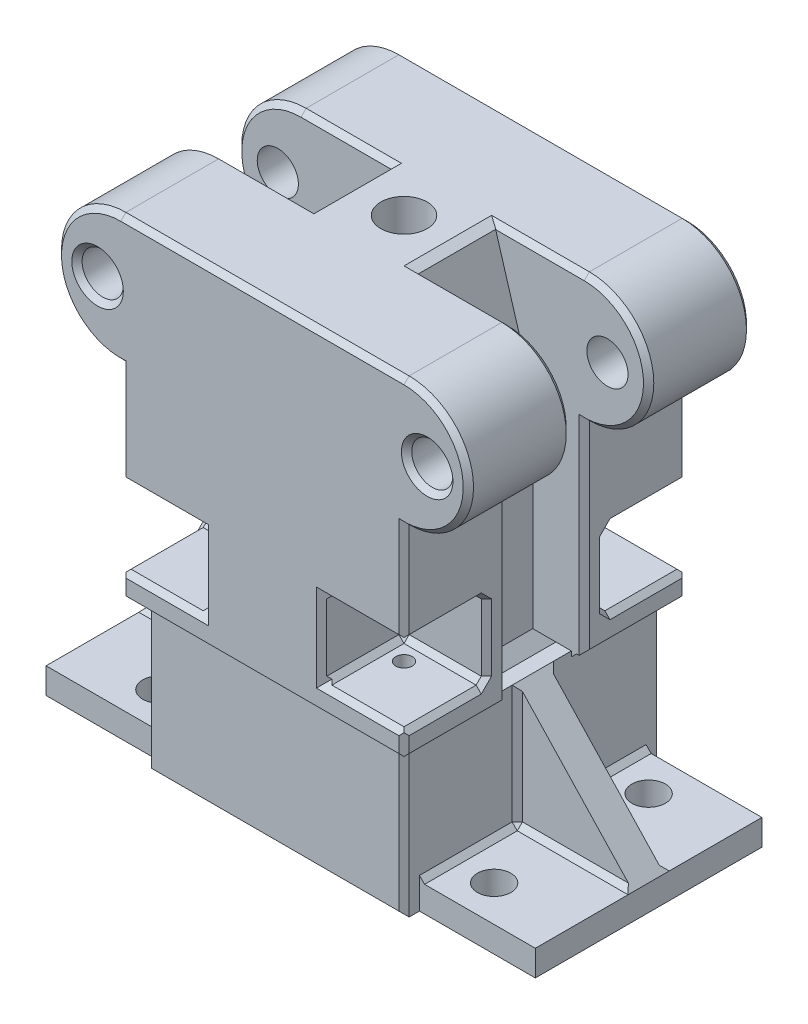
from build123d import *
from OCP.BRepFilletAPI import BRepFilletAPI_MakeChamfer

# Parameters (mm, degrees)
CROQUIS1_W              = 80
CROQUIS1_H              = 25
CROQUIS1_R              = 4
SALIENTE_EXTRUIR1_DEPTH = 27.5
REDONDEO1_RADIUS        = 12.5
REDONDEO1_LENGTH        = 55
REDONDEO2_RADIUS        = 12.5
REDONDEO2_LENGTH        = 55
CROQUIS2_R              = 4.5
CROQUIS2_W              = 12.5
CROQUIS2_H              = 15
CORTAR_EXTRUIR1_DEPTH   = 55.60082417
CORTAR_EXTRUIR2_START   = -20
CORTAR_EXTRUIR2_DEPTH   = 15
SKETCH3_R               = 4.5
BOSS_EXTRUDE1_DEPTH     = 39.5
SKETCH5_R               = 15
CUT_EXTRUDE1_DEPTH      = 3
SKETCH7_R               = 1.6
CUT_EXTRUDE3_DEPTH      = 15
CIRPATTERN1_COUNT       = 4
SKETCH6_R               = 10.5
CUT_EXTRUDE2_DEPTH      = 42
SKETCH8_W               = 8
SKETCH8_H               = 8
CUT_EXTRUDE4_DEPTH      = 15
CIRPATTERN2_COUNT       = 4
SKETCH10_W              = 50
SKETCH10_H              = 50
SKETCH10_W_2            = 44
SKETCH10_H_2            = 44
BOSS_EXTRUDE2_DEPTH     = 29
SKETCH14_W              = 22.5
SKETCH14_H              = 44
BOSS_EXTRUDE3_DEPTH     = 5
SKETCH15_R              = 3.25
CUT_EXTRUDE5_DEPTH      = 7
CHAMFER1_SIZE           = 1
CHAMFER2_SIZE           = 1
CHAMFER2_SIZE2          = 1.491472358
RIB1_REACH              = 99.844
SKETCH16_WALL_W         = 230.586096322
SKETCH16_WALL_H         = 6
CHAMFER3_SIZE           = 1
CHAMFER4_SIZE           = 1


with BuildPart() as part:
    # Croquis1 → Saliente-Extruir1 (new, symmetric)
    with BuildSketch(Plane.XY):
        Rectangle(CROQUIS1_W, CROQUIS1_H)
        with Locations((-32, 0)):
            Circle(CROQUIS1_R, mode=Mode.SUBTRACT)
        with Locations((32, 0)):
            Circle(CROQUIS1_R, mode=Mode.SUBTRACT)
    extrude(amount=SALIENTE_EXTRUIR1_DEPTH, both=True)

    # Redondeo1: full round fillet: the end face becomes a half cylinder, R = half its width
    redondeo1_face = Plane((-40, 0, 0), x_dir=(0, 0, 1), z_dir=(-1, 0, 0))  # on the end face: x along it, z out of the body
    redondeo1_slab = redondeo1_face.offset(-REDONDEO1_RADIUS / 2) * Box(REDONDEO1_LENGTH, 2 * REDONDEO1_RADIUS, REDONDEO1_RADIUS, mode=Mode.PRIVATE)  # the body's end, R deep
    redondeo1_round = Plane((-27.5, 0, 0), x_dir=(-1, 0, 0), z_dir=(0, 0, 1)) * Cylinder(REDONDEO1_RADIUS, REDONDEO1_LENGTH, mode=Mode.PRIVATE)  # its axis R under the face
    add(redondeo1_slab - redondeo1_round, mode=Mode.SUBTRACT)

    # Redondeo2: full round fillet: the end face becomes a half cylinder, R = half its width
    redondeo2_face = Plane((40, 0, 0), x_dir=(0, 0, -1), z_dir=(1, 0, 0))  # on the end face: x along it, z out of the body
    redondeo2_slab = redondeo2_face.offset(-REDONDEO2_RADIUS / 2) * Box(REDONDEO2_LENGTH, 2 * REDONDEO2_RADIUS, REDONDEO2_RADIUS, mode=Mode.PRIVATE)  # the body's end, R deep
    redondeo2_round = Plane((27.5, 0, 0), x_dir=(1, 0, 0), z_dir=(0, 0, -1)) * Cylinder(REDONDEO2_RADIUS, REDONDEO2_LENGTH, mode=Mode.PRIVATE)  # its axis R under the face
    add(redondeo2_slab - redondeo2_round, mode=Mode.SUBTRACT)

    # Croquis2 → Cortar-Extruir1 (cut, through all)
    with BuildSketch(Plane(origin=(0, 12.5, 0), x_dir=(1, 0, 0), z_dir=(0, 1, 0))):
        with Locations(Location((0, 0, 0), (0, 0, 270))):
            Circle(CROQUIS2_R)
        with Locations((-33.75, 0)):
            Rectangle(CROQUIS2_W, CROQUIS2_H)
        with Locations((33.75, 0)):
            Rectangle(CROQUIS2_W, CROQUIS2_H)
    extrude(amount=-CORTAR_EXTRUIR1_DEPTH, mode=Mode.SUBTRACT)

    # Croquis3 → Cortar-Extruir2 (cut)
    with BuildSketch(Plane(origin=(0, 0, -27.5), x_dir=(-1, 0, 0), z_dir=(0, 0, -1)).offset(CORTAR_EXTRUIR2_START)):
        Polygon((10, 12.5), (27.5, 12.5), (27.5, -12.5), (17.5, -12.5), align=None)
    cortar_extruir2 = extrude(amount=-CORTAR_EXTRUIR2_DEPTH, mode=Mode.SUBTRACT)

    # Simetría1: Cortar-Extruir2 across plane
    add(cortar_extruir2.mirror(Plane(origin=(0, 0, 0), x_dir=(0, 0, 1), z_dir=(1, 0, 0))), mode=Mode.SUBTRACT)

    # Sketch3 → Boss-Extrude1 (add)
    with BuildSketch(Plane.XZ.offset(12.5)):
        Polygon((27.5, -7.5), (17.5, -7.5), (17.5, 7.5), (27.5, 7.5), (27.5, 27.5), (-27.5, 27.5), (-27.5, 7.5), (-17.5, 7.5), (-17.5, -7.5), (-27.5, -7.5), (-27.5, -27.5), (27.5, -27.5), align=None)
        with Locations(Location((0, 0, 0), (0, 0, 90))):
            Circle(SKETCH3_R, mode=Mode.SUBTRACT)
    extrude(amount=BOSS_EXTRUDE1_DEPTH)

    # Sketch5 → Cut-Extrude1 (cut)
    with BuildSketch(Plane.XZ.offset(52)):
        with Locations(Location((0, 0, 0), (0, 0, 270))):
            Circle(SKETCH5_R)
    extrude(amount=-CUT_EXTRUDE1_DEPTH, mode=Mode.SUBTRACT)

    # Sketch7 → Cut-Extrude3 (cut)
    with BuildSketch(Plane.XZ.offset(52)):
        with Locations(Location((-15.5, 15.5, 0), (0, 0, 270))):
            Circle(SKETCH7_R)
    cut_extrude3 = extrude(amount=-CUT_EXTRUDE3_DEPTH, mode=Mode.SUBTRACT)

    # CirPattern1: Cut-Extrude3 ×4 about axis
    cirpattern1_axis = Axis((0, 0, 0), (0, 1, 0))
    for i in range(1, CIRPATTERN1_COUNT):
        add(cut_extrude3.rotate(cirpattern1_axis, i * 360 / CIRPATTERN1_COUNT), mode=Mode.SUBTRACT)

    # Sketch6 → Cut-Extrude2 (cut)
    with BuildSketch(Plane.XZ.offset(49)):
        with Locations(Location((0, 0, 0), (0, 0, 270))):
            Circle(SKETCH6_R)
    extrude(amount=-CUT_EXTRUDE2_DEPTH, mode=Mode.SUBTRACT)

    # Sketch8 → Cut-Extrude4 (cut)
    with BuildSketch(Plane(origin=(0, -47, 0), x_dir=(-1, 0, 0), z_dir=(0, -1, 0))):
        Polygon((-27.5, 27.5), (-11.5, 27.5), (-11.5, 19.5), (-19.5, 19.5), (-19.5, 11.5), (-27.5, 11.5), align=None)
        with Locations((-15.5, 15.5)):
            Rectangle(SKETCH8_W, SKETCH8_H)
    cut_extrude4 = extrude(amount=-CUT_EXTRUDE4_DEPTH, mode=Mode.SUBTRACT)

    # CirPattern2: Cut-Extrude4 ×4 about axis
    cirpattern2_axis = Axis((0, -49, 0), (0, -1, 0))
    for i in range(1, CIRPATTERN2_COUNT):
        add(cut_extrude4.rotate(cirpattern2_axis, i * 360 / CIRPATTERN2_COUNT), mode=Mode.SUBTRACT)

    # Sketch10 → Boss-Extrude2 (add)
    with BuildSketch(Plane.XZ.offset(52)):
        Rectangle(SKETCH10_W, SKETCH10_H)
        Rectangle(SKETCH10_W_2, SKETCH10_H_2, mode=Mode.SUBTRACT)
    extrude(amount=BOSS_EXTRUDE2_DEPTH)

    # Sketch14 → Boss-Extrude3 (add)
    with BuildSketch(Plane.XZ.offset(81)):
        with Locations((-36.25, 0)):
            Rectangle(SKETCH14_W, SKETCH14_H)
        with Locations((36.25, 0)):
            Rectangle(SKETCH14_W, SKETCH14_H)
    extrude(amount=-BOSS_EXTRUDE3_DEPTH)

    # Sketch15 → Cut-Extrude5 (cut)
    with BuildSketch(Plane.XZ.offset(81)):
        with Locations(Location((-32.5, 15, 0), (0, 0, 270))):
            Circle(SKETCH15_R)
        with Locations(Location((-32.5, -15, 0), (0, 0, 270))):
            Circle(SKETCH15_R)
        with Locations(Location((32.5, -15, 0), (0, 0, 270))):
            Circle(SKETCH15_R)
        with Locations(Location((32.5, 15, 0), (0, 0, 270))):
            Circle(SKETCH15_R)
    extrude(amount=-CUT_EXTRUDE5_DEPTH, mode=Mode.SUBTRACT)

    # Chamfer1
    chamfer1_edges = [part.edges().sort_by_distance(p)[0] for p in [
        (0, -52, 27.5),
        (0, -52, -27.5),
        (27.5, -49.5, -27.5),
        (27.5, -49.5, 27.5),
        (-27.5, -49.5, 27.5),
        (-27.5, -49.5, -27.5),
        (-36, 0, -27.5),
        (-36, 0, 27.5),
        (28, 0, -27.5),
        (28, 0, 27.5),
        (27.5, -22.25, -27.5),
        (19.5, -47, -27.5),
        (11.5, -39.5, -27.5),
        (19.5, -32, -27.5),
        (-27.5, -22.25, -27.5),
        (-27.5, -22.25, 27.5),
        (27.5, -22.25, 27.5),
        (19.5, -47, 27.5),
        (11.5, -39.5, 27.5),
        (19.5, -32, 27.5),
        (-19.5, -47, 27.5),
        (-11.5, -39.5, 27.5),
        (-19.5, -32, 27.5),
        (-19.5, -47, -27.5),
        (-11.5, -39.5, -27.5),
        (-19.5, -32, -27.5),
        (25, -52, 16.25),
        (-25, -52, -16.25),
        (-40, 0, -27.5),
        (0, -81, 25),
        (0, -81, -25),
        (25, -52, -16.25),
        (25, -66.5, -25),
        (0, -52, 25),
        (25, -66.5, 25),
        (-25, -52, 16.25),
        (-25, -66.5, 25),
        (0, -52, -25),
        (-25, -66.5, -25),
        (-40, 0, 27.5),
        (0, 12.5, -27.5),
        (0, 12.5, 27.5),
        (40, 0, 27.5),
        (40, 0, -27.5),
    ]]
    chamfer(chamfer1_edges, length=CHAMFER1_SIZE)

    # Chamfer2: one chamfer whose edges measure the first distance from different faces: ONE call of the kernel's chamfer builder (chamfer() names one face for all edges)
    chamfer2_edges_1 = [part.edges().sort_by_distance(p)[0] for p in [
        (18.75, 12.5, -7.5),
        (18.75, 12.5, 7.5),
        (27.5, -52, 17),
        (27.5, -32.25, -7.5),
        (27.5, -32.25, 7.5),
        (-27.5, -32.25, 7.5),
        (-27.5, -32.25, -7.5),
        (11.5, -47, -19),
        (19.5, -47, -11.5),
        (11.5, -39.5, -11.5),
        (27.5, -47, -19),
        (27.5, -39.5, -11.5),
        (11.5, -32, -19),
        (19.5, -32, -11.5),
        (27.5, -32, -19),
        (19.5, -47, 11.5),
        (11.5, -47, 19),
        (11.5, -39.5, 11.5),
        (19.5, -32, 11.5),
        (27.5, -39.5, 11.5),
        (11.5, -32, 19),
        (-11.5, -47, 19),
        (-19.5, -47, 11.5),
        (-11.5, -39.5, 11.5),
        (-27.5, -47, 19),
        (-27.5, -39.5, 11.5),
        (-11.5, -32, 19),
        (-19.5, -32, 11.5),
        (-27.5, -32, 19),
        (-19.5, -47, -11.5),
        (-11.5, -47, -19),
        (-11.5, -39.5, -11.5),
        (-19.5, -32, -11.5),
        (-27.5, -39.5, -11.5),
        (-11.5, -32, -19),
        (27.5, -52, -17),
        (-27.5, -47, -19),
        (-27.5, -32, -19),
        (27.5, -47, 19),
        (27.5, -32, 19),
        (-40, 0, -7.5),
        (-40, 0, 7.5),
        (40, 0, -7.5),
        (40, 0, 7.5),
        (-18.75, 12.5, -7.5),
        (-18.75, 12.5, 7.5),
    ]]
    chamfer2_edges_2 = [part.edges().sort_by_distance(p)[0] for p in [
        (10, 12.5, 0),
    ]]
    chamfer2_side_2 = [part.faces().sort_by_distance(p)[0] for p in [
        (13.75, 0, 0),
    ]]
    chamfer2_edges_3 = [part.edges().sort_by_distance(p)[0] for p in [
        (-10, 12.5, 0),
    ]]
    chamfer2_side_3 = [part.faces().sort_by_distance(p)[0] for p in [
        (26.736193742, 12.5, 17),
    ]]
    chamfer2 = BRepFilletAPI_MakeChamfer(part.part.solid().wrapped)
    for e in chamfer2_edges_1:
        chamfer2.Add(CHAMFER2_SIZE, e.wrapped)
    for e in chamfer2_edges_2:
        chamfer2.Add(CHAMFER2_SIZE, CHAMFER2_SIZE2, e.wrapped, chamfer2_side_2[0].wrapped)  # the first distance lies on this face
    for e in chamfer2_edges_3:
        chamfer2.Add(CHAMFER2_SIZE, CHAMFER2_SIZE2, e.wrapped, chamfer2_side_3[0].wrapped)  # the first distance lies on this face
    add(Compound.cast(chamfer2.Shape()), mode=Mode.REPLACE)

    # Sketch16 wall → Rib1 (add, up to next)
    with BuildSketch(Plane(origin=(-36.25, -64, 0), x_dir=(0.683941128881, 0.72953720414, 0), z_dir=(-0.72953720414, 0.683941128881, 0)), mode=Mode.PRIVATE) as rib1_sk1:
        Rectangle(SKETCH16_WALL_W, SKETCH16_WALL_H)
    rib1_tool1 = extrude(rib1_sk1.sketch, amount=-RIB1_REACH, mode=Mode.PRIVATE) - part.part
    rib1 = rib1_tool1.solids().sort_by_distance((-36.25, -64, 0))[0]
    add(rib1)

    # Chamfer3
    chamfer3_edges = [part.edges().sort_by_distance(p)[0] for p in [
        (-25, -76, -12.5),
        (-25, -76, 12.5),
        (-36.25, -76, -3),
        (-36.25, -76, 3),
        (-25, -64, 3),
        (-25, -64, -3),
    ]]
    chamfer(chamfer3_edges, length=CHAMFER3_SIZE)

    # Mirror2: Rib1 across plane
    add(rib1.mirror(Plane(origin=(0, 0, 0), x_dir=(0, 0, 1), z_dir=(1, 0, 0))))

    # Chamfer4
    chamfer4_edges = [part.edges().sort_by_distance(p)[0] for p in [
        (25, -76, 12.5),
        (25, -76, -12.5),
        (36.25, -76, -3),
        (25, -64, -3),
        (25, -64, 3),
        (36.25, -76, 3),
    ]]
    chamfer(chamfer4_edges, length=CHAMFER4_SIZE)


solid = part.part
